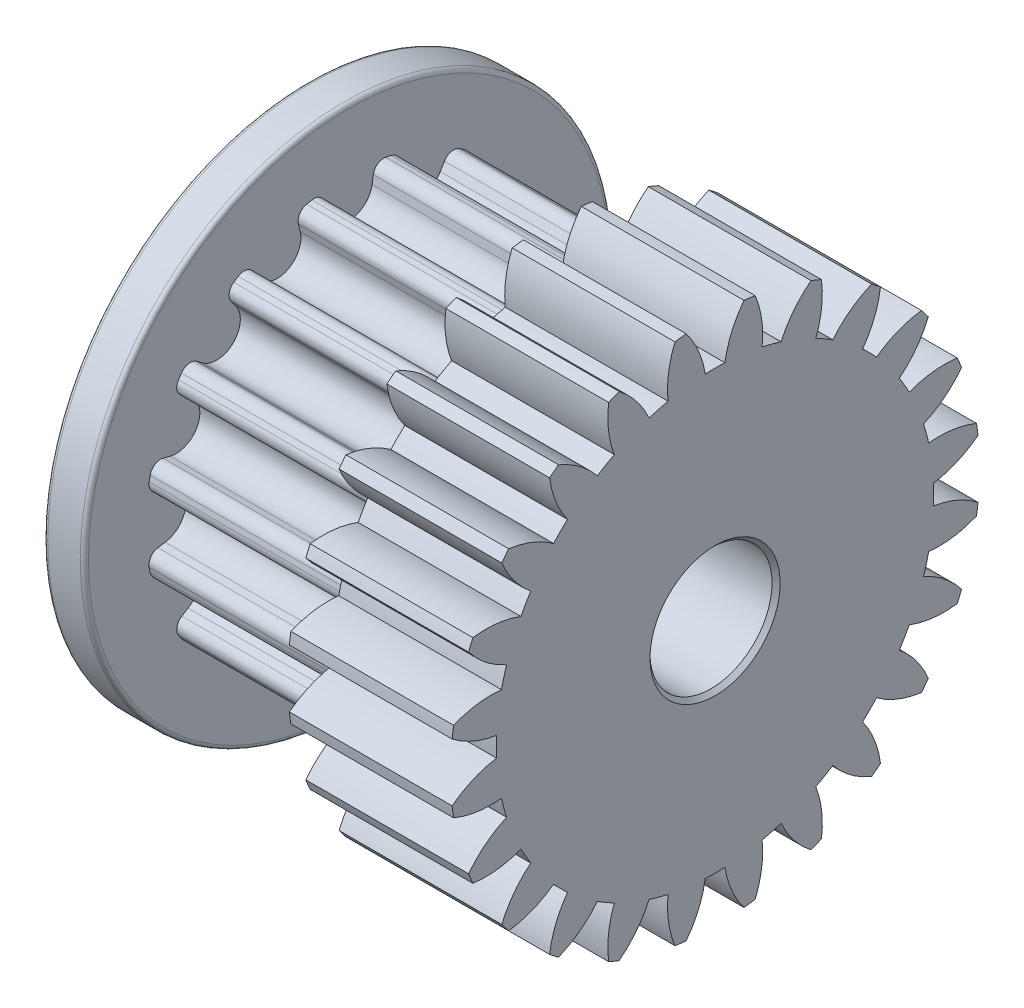
from build123d import *

# Parameters (mm, degrees)
SKETCH_1_R          = 1.5
EXTRUDE_1_DEPTH     = 4
EXTRUDE_2_DEPTH     = 5
EXTRUDE_START       = 1
SKETCH_3_R          = 6.5
EXTRUDE_3_DEPTH     = 1
SKETCH_5_R          = 1.5
CUT_EXTRUDE_1_DEPTH = 14.583077707
CHAMFER_1_SIZE      = 0.1
FILLET_1_R          = 0.1


with BuildPart() as part:
    # 草图1 → 凸台-拉伸1 (new body)
    with BuildSketch(Plane(origin=(0, 0, 0), x_dir=(0, -1, 0), z_dir=(-1, 0, 0))):
        with BuildLine():
            ThreePointArc((-0.711337602, 6.460959589), (-0.848420249, 6.444391599), (-0.98512003, 6.424915449))
            ThreePointArc((-0.98512003, 6.424915449), (-1.144628565, 5.84730165), (-1.156074481, 5.248177569))
            ThreePointArc((-1.156074481, 5.248177569), (-1.390893548, 5.19088539), (-1.622898915, 5.123092339))
            ThreePointArc((-1.622898915, 5.123092339), (-1.93237341, 5.636226055), (-2.359318752, 6.056700011))
            ThreePointArc((-2.359318752, 6.056700011), (-2.48744231, 6.005216961), (-2.614443361, 5.951023938))
            ThreePointArc((-2.614443361, 5.951023938), (-2.619019322, 5.351808006), (-2.475010506, 4.770136161))
            ThreePointArc((-2.475010506, 4.770136161), (-2.687, 4.65402052), (-2.893553842, 4.528490053))
            ThreePointArc((-2.893553842, 4.528490053), (-3.325292028, 4.944041268), (-3.846516229, 5.239686336))
            ThreePointArc((-3.846516229, 5.239686336), (-3.956949289, 5.156796712), (-4.065596697, 5.071579981))
            ThreePointArc((-4.065596697, 5.071579981), (-3.91492824, 4.49159749), (-3.625278654, 3.967017857))
            ThreePointArc((-3.625278654, 3.967017857), (-3.799991842, 3.799991842), (-3.967017857, 3.625278654))
            ThreePointArc((-3.967017857, 3.625278654), (-4.49159749, 3.91492824), (-5.071579981, 4.065596697))
            ThreePointArc((-5.071579981, 4.065596697), (-5.156796712, 3.956949289), (-5.239686336, 3.846516229))
            ThreePointArc((-5.239686336, 3.846516229), (-4.944041268, 3.325292028), (-4.528490053, 2.893553842))
            ThreePointArc((-4.528490053, 2.893553842), (-4.65402052, 2.687), (-4.770136161, 2.475010506))
            ThreePointArc((-4.770136161, 2.475010506), (-5.351808006, 2.619019322), (-5.951023938, 2.614443361))
            ThreePointArc((-5.951023938, 2.614443361), (-6.005216961, 2.48744231), (-6.056700011, 2.359318752))
            ThreePointArc((-6.056700011, 2.359318752), (-5.636226055, 1.93237341), (-5.123092339, 1.622898915))
            ThreePointArc((-5.123092339, 1.622898915), (-5.19088539, 1.390893548), (-5.248177569, 1.156074481))
            ThreePointArc((-5.248177569, 1.156074481), (-5.84730165, 1.144628565), (-6.424915449, 0.98512003))
            ThreePointArc((-6.424915449, 0.98512003), (-6.444391599, 0.848420249), (-6.460959589, 0.711337602))
            ThreePointArc((-6.460959589, 0.711337602), (-5.94431135, 0.407766737), (-5.368564348, 0.241646108))
            ThreePointArc((-5.368564348, 0.241646108), (-5.374, 0), (-5.368564348, -0.241646108))
            ThreePointArc((-5.368564348, -0.241646108), (-5.94431135, -0.407766737), (-6.460959589, -0.711337602))
            ThreePointArc((-6.460959589, -0.711337602), (-6.444391599, -0.848420249), (-6.424915449, -0.98512003))
            ThreePointArc((-6.424915449, -0.98512003), (-5.84730165, -1.144628565), (-5.248177569, -1.156074481))
            ThreePointArc((-5.248177569, -1.156074481), (-5.19088539, -1.390893548), (-5.123092339, -1.622898915))
            ThreePointArc((-5.123092339, -1.622898915), (-5.636226055, -1.93237341), (-6.056700011, -2.359318752))
            ThreePointArc((-6.056700011, -2.359318752), (-6.005216961, -2.48744231), (-5.951023938, -2.614443361))
            ThreePointArc((-5.951023938, -2.614443361), (-5.351808006, -2.619019322), (-4.770136161, -2.475010506))
            ThreePointArc((-4.770136161, -2.475010506), (-4.65402052, -2.687), (-4.528490053, -2.893553842))
            ThreePointArc((-4.528490053, -2.893553842), (-4.944041268, -3.325292028), (-5.239686336, -3.846516229))
            ThreePointArc((-5.239686336, -3.846516229), (-5.156796712, -3.956949289), (-5.071579981, -4.065596697))
            ThreePointArc((-5.071579981, -4.065596697), (-4.49159749, -3.91492824), (-3.967017857, -3.625278654))
            ThreePointArc((-3.967017857, -3.625278654), (-3.799991842, -3.799991842), (-3.625278654, -3.967017857))
            ThreePointArc((-3.625278654, -3.967017857), (-3.91492824, -4.49159749), (-4.065596697, -5.071579981))
            ThreePointArc((-4.065596697, -5.071579981), (-3.956949289, -5.156796712), (-3.846516229, -5.239686336))
            ThreePointArc((-3.846516229, -5.239686336), (-3.325292028, -4.944041268), (-2.893553842, -4.528490053))
            ThreePointArc((-2.893553842, -4.528490053), (-2.687, -4.65402052), (-2.475010506, -4.770136161))
            ThreePointArc((-2.475010506, -4.770136161), (-2.619019322, -5.351808006), (-2.614443361, -5.951023938))
            ThreePointArc((-2.614443361, -5.951023938), (-2.48744231, -6.005216961), (-2.359318752, -6.056700011))
            ThreePointArc((-2.359318752, -6.056700011), (-1.93237341, -5.636226055), (-1.622898915, -5.123092339))
            ThreePointArc((-1.622898915, -5.123092339), (-1.390893548, -5.19088539), (-1.156074481, -5.248177569))
            ThreePointArc((-1.156074481, -5.248177569), (-1.144628565, -5.84730165), (-0.98512003, -6.424915449))
            ThreePointArc((-0.98512003, -6.424915449), (-0.848420249, -6.444391599), (-0.711337602, -6.460959589))
            ThreePointArc((-0.711337602, -6.460959589), (-0.407766737, -5.94431135), (-0.241646108, -5.368564348))
            ThreePointArc((-0.241646108, -5.368564348), (0, -5.374), (0.241646108, -5.368564348))
            ThreePointArc((0.241646108, -5.368564348), (0.407766737, -5.94431135), (0.711337602, -6.460959589))
            ThreePointArc((0.711337602, -6.460959589), (0.848420249, -6.444391599), (0.98512003, -6.424915449))
            ThreePointArc((0.98512003, -6.424915449), (1.144628565, -5.84730165), (1.156074481, -5.248177569))
            ThreePointArc((1.156074481, -5.248177569), (1.390893548, -5.19088539), (1.622898915, -5.123092339))
            ThreePointArc((1.622898915, -5.123092339), (1.93237341, -5.636226055), (2.359318752, -6.056700011))
            ThreePointArc((2.359318752, -6.056700011), (2.48744231, -6.005216961), (2.614443361, -5.951023938))
            ThreePointArc((2.614443361, -5.951023938), (2.619019322, -5.351808006), (2.475010506, -4.770136161))
            ThreePointArc((2.475010506, -4.770136161), (2.687, -4.65402052), (2.893553842, -4.528490053))
            ThreePointArc((2.893553842, -4.528490053), (3.325292028, -4.944041268), (3.846516229, -5.239686336))
            ThreePointArc((3.846516229, -5.239686336), (3.956949289, -5.156796712), (4.065596697, -5.071579981))
            ThreePointArc((4.065596697, -5.071579981), (3.91492824, -4.49159749), (3.625278654, -3.967017857))
            ThreePointArc((3.625278654, -3.967017857), (3.799991842, -3.799991842), (3.967017857, -3.625278654))
            ThreePointArc((3.967017857, -3.625278654), (4.49159749, -3.91492824), (5.071579981, -4.065596697))
            ThreePointArc((5.071579981, -4.065596697), (5.156796712, -3.956949289), (5.239686336, -3.846516229))
            ThreePointArc((5.239686336, -3.846516229), (4.944041268, -3.325292028), (4.528490053, -2.893553842))
            ThreePointArc((4.528490053, -2.893553842), (4.65402052, -2.687), (4.770136161, -2.475010506))
            ThreePointArc((4.770136161, -2.475010506), (5.351808006, -2.619019322), (5.951023938, -2.614443361))
            ThreePointArc((5.951023938, -2.614443361), (6.005216961, -2.48744231), (6.056700011, -2.359318752))
            ThreePointArc((6.056700011, -2.359318752), (5.636226055, -1.93237341), (5.123092339, -1.622898915))
            ThreePointArc((5.123092339, -1.622898915), (5.19088539, -1.390893548), (5.248177569, -1.156074481))
            ThreePointArc((5.248177569, -1.156074481), (5.84730165, -1.144628565), (6.424915449, -0.98512003))
            ThreePointArc((6.424915449, -0.98512003), (6.444391599, -0.848420249), (6.460959589, -0.711337602))
            ThreePointArc((6.460959589, -0.711337602), (5.94431135, -0.407766737), (5.368564348, -0.241646108))
            ThreePointArc((5.368564348, -0.241646108), (5.374, 0), (5.368564348, 0.241646108))
            ThreePointArc((5.368564348, 0.241646108), (5.94431135, 0.407766737), (6.460959589, 0.711337602))
            ThreePointArc((6.460959589, 0.711337602), (6.444391599, 0.848420249), (6.424915449, 0.98512003))
            ThreePointArc((6.424915449, 0.98512003), (5.84730165, 1.144628565), (5.248177569, 1.156074481))
            ThreePointArc((5.248177569, 1.156074481), (5.19088539, 1.390893548), (5.123092339, 1.622898915))
            ThreePointArc((5.123092339, 1.622898915), (5.636226055, 1.93237341), (6.056700011, 2.359318752))
            ThreePointArc((6.056700011, 2.359318752), (6.005216961, 2.48744231), (5.951023938, 2.614443361))
            ThreePointArc((5.951023938, 2.614443361), (5.351808006, 2.619019322), (4.770136161, 2.475010506))
            ThreePointArc((4.770136161, 2.475010506), (4.65402052, 2.687), (4.528490053, 2.893553842))
            ThreePointArc((4.528490053, 2.893553842), (4.944041268, 3.325292028), (5.239686336, 3.846516229))
            ThreePointArc((5.239686336, 3.846516229), (5.156796712, 3.956949289), (5.071579981, 4.065596697))
            ThreePointArc((5.071579981, 4.065596697), (4.49159749, 3.91492824), (3.967017857, 3.625278654))
            ThreePointArc((3.967017857, 3.625278654), (3.799991842, 3.799991842), (3.625278654, 3.967017857))
            ThreePointArc((3.625278654, 3.967017857), (3.91492824, 4.49159749), (4.065596697, 5.071579981))
            ThreePointArc((4.065596697, 5.071579981), (3.956949289, 5.156796712), (3.846516229, 5.239686336))
            ThreePointArc((3.846516229, 5.239686336), (3.325292028, 4.944041268), (2.893553842, 4.528490053))
            ThreePointArc((2.893553842, 4.528490053), (2.687, 4.65402052), (2.475010506, 4.770136161))
            ThreePointArc((2.475010506, 4.770136161), (2.619019322, 5.351808006), (2.614443361, 5.951023938))
            ThreePointArc((2.614443361, 5.951023938), (2.48744231, 6.005216961), (2.359318752, 6.056700011))
            ThreePointArc((2.359318752, 6.056700011), (1.93237341, 5.636226055), (1.622898915, 5.123092339))
            ThreePointArc((1.622898915, 5.123092339), (1.390893548, 5.19088539), (1.156074481, 5.248177569))
            ThreePointArc((1.156074481, 5.248177569), (1.144628565, 5.84730165), (0.98512003, 6.424915449))
            ThreePointArc((0.98512003, 6.424915449), (0.848420249, 6.444391599), (0.711337602, 6.460959589))
            ThreePointArc((0.711337602, 6.460959589), (0.407766737, 5.94431135), (0.241646108, 5.368564348))
            ThreePointArc((0.241646108, 5.368564348), (0, 5.374), (-0.241646108, 5.368564348))
            ThreePointArc((-0.241646108, 5.368564348), (-0.407766737, 5.94431135), (-0.711337602, 6.460959589))
        make_face()
        with Locations(Location((0, 0, 0), (0, 0, 90))):
            Circle(SKETCH_1_R, mode=Mode.SUBTRACT)
    extrude(amount=-EXTRUDE_1_DEPTH)

    # 草图2 → 凸台-拉伸2 (add)
    with BuildSketch(Plane.ZY):
        with BuildLine():
            Line((0.973500707, 4.894118549), (1.037379867, 4.881412194))
            ThreePointArc((1.037379867, 4.881412194), (1.206083752, 4.765877122), (1.239075855, 4.564082984))
            Line((1.239075855, 4.564082984), (1.190890986, 4.368931892))
            ThreePointArc((1.190890986, 4.368931892), (1.544766642, 3.700642421), (2.258591893, 3.950226689))
            Line((2.258591893, 3.950226689), (2.351135088, 4.103452967))
            ThreePointArc((2.351135088, 4.103452967), (2.517154032, 4.222814031), (2.718141325, 4.185218003))
            Line((2.718141325, 4.185218003), (2.772295463, 4.149033365))
            Line((2.772295463, 4.149033365), (2.8264496, 4.112848728))
            ThreePointArc((2.8264496, 4.112848728), (2.938098308, 3.941548058), (2.891355764, 3.742489052))
            Line((2.891355764, 3.742489052), (2.77215766, 3.580632503))
            ThreePointArc((2.77215766, 3.580632503), (2.843352827, 2.827791189), (3.59835313, 2.785207889))
            Line((3.59835313, 2.785207889), (3.742489052, 2.891355764))
            ThreePointArc((3.742489052, 2.891355764), (3.941548058, 2.938098308), (4.112848728, 2.8264496))
            Line((4.112848728, 2.8264496), (4.149033365, 2.772295463))
            Line((4.149033365, 2.772295463), (4.185218003, 2.718141325))
            ThreePointArc((4.185218003, 2.718141325), (4.222814031, 2.517154032), (4.103452967, 2.351135088))
            Line((4.103452967, 2.351135088), (3.931388459, 2.247214275))
            ThreePointArc((3.931388459, 2.247214275), (3.709064318, 1.524434383), (4.390297723, 1.196166436))
            Line((4.390297723, 1.196166436), (4.564082984, 1.239075855))
            ThreePointArc((4.564082984, 1.239075855), (4.765877122, 1.206083752), (4.881412194, 1.037379867))
            Line((4.881412194, 1.037379867), (4.894118549, 0.973500707))
            Line((4.894118549, 0.973500707), (4.906824904, 0.909621546))
            ThreePointArc((4.906824904, 0.909621546), (4.864644598, 0.709546123), (4.690836654, 0.60184212))
            Line((4.690836654, 0.60184212), (4.492101004, 0.571678044))
            ThreePointArc((4.492101004, 0.571678044), (4.010104391, -0.011003739), (4.513859285, -0.574980514))
            Line((4.513859285, -0.574980514), (4.690836654, -0.60184212))
            ThreePointArc((4.690836654, -0.60184212), (4.864644598, -0.709546123), (4.906824904, -0.909621546))
            Line((4.906824904, -0.909621546), (4.894118549, -0.973500707))
            Line((4.894118549, -0.973500707), (4.881412194, -1.037379867))
            ThreePointArc((4.881412194, -1.037379867), (4.765877122, -1.206083752), (4.564082984, -1.239075855))
            Line((4.564082984, -1.239075855), (4.368931892, -1.190890986))
            ThreePointArc((4.368931892, -1.190890986), (3.700642421, -1.544766642), (3.950226689, -2.258591893))
            Line((3.950226689, -2.258591893), (4.103452967, -2.351135088))
            ThreePointArc((4.103452967, -2.351135088), (4.222814031, -2.517154032), (4.185218003, -2.718141325))
            Line((4.185218003, -2.718141325), (4.149033365, -2.772295463))
            Line((4.149033365, -2.772295463), (4.112848728, -2.8264496))
            ThreePointArc((4.112848728, -2.8264496), (3.941548058, -2.938098308), (3.742489052, -2.891355764))
            Line((3.742489052, -2.891355764), (3.580632503, -2.77215766))
            ThreePointArc((3.580632503, -2.77215766), (2.827791189, -2.843352827), (2.785207889, -3.59835313))
            Line((2.785207889, -3.59835313), (2.891355764, -3.742489052))
            ThreePointArc((2.891355764, -3.742489052), (2.938098308, -3.941548058), (2.8264496, -4.112848728))
            Line((2.8264496, -4.112848728), (2.772295463, -4.149033365))
            Line((2.772295463, -4.149033365), (2.718141325, -4.185218003))
            ThreePointArc((2.718141325, -4.185218003), (2.517154032, -4.222814031), (2.351135088, -4.103452967))
            Line((2.351135088, -4.103452967), (2.247214275, -3.931388459))
            ThreePointArc((2.247214275, -3.931388459), (1.524434383, -3.709064318), (1.196166436, -4.390297723))
            Line((1.196166436, -4.390297723), (1.239075855, -4.564082984))
            ThreePointArc((1.239075855, -4.564082984), (1.206083752, -4.765877122), (1.037379867, -4.881412194))
            Line((1.037379867, -4.881412194), (0.973500707, -4.894118549))
            Line((0.973500707, -4.894118549), (0.909621546, -4.906824904))
            ThreePointArc((0.909621546, -4.906824904), (0.709546123, -4.864644598), (0.60184212, -4.690836654))
            Line((0.60184212, -4.690836654), (0.571678044, -4.492101004))
            ThreePointArc((0.571678044, -4.492101004), (-0.011003739, -4.010104391), (-0.574980514, -4.513859285))
            Line((-0.574980514, -4.513859285), (-0.60184212, -4.690836654))
            ThreePointArc((-0.60184212, -4.690836654), (-0.709546123, -4.864644598), (-0.909621546, -4.906824904))
            Line((-0.909621546, -4.906824904), (-0.973500707, -4.894118549))
            Line((-0.973500707, -4.894118549), (-1.037379867, -4.881412194))
            ThreePointArc((-1.037379867, -4.881412194), (-1.206083752, -4.765877122), (-1.239075855, -4.564082984))
            Line((-1.239075855, -4.564082984), (-1.190890986, -4.368931892))
            ThreePointArc((-1.190890986, -4.368931892), (-1.544766642, -3.700642421), (-2.258591893, -3.950226689))
            Line((-2.258591893, -3.950226689), (-2.351135088, -4.103452967))
            ThreePointArc((-2.351135088, -4.103452967), (-2.517154032, -4.222814031), (-2.718141325, -4.185218003))
            Line((-2.718141325, -4.185218003), (-2.772295463, -4.149033365))
            Line((-2.772295463, -4.149033365), (-2.8264496, -4.112848728))
            ThreePointArc((-2.8264496, -4.112848728), (-2.938098308, -3.941548058), (-2.891355764, -3.742489052))
            Line((-2.891355764, -3.742489052), (-2.77215766, -3.580632503))
            ThreePointArc((-2.77215766, -3.580632503), (-2.843352827, -2.827791189), (-3.59835313, -2.785207889))
            Line((-3.59835313, -2.785207889), (-3.742489052, -2.891355764))
            ThreePointArc((-3.742489052, -2.891355764), (-3.941548058, -2.938098308), (-4.112848728, -2.8264496))
            Line((-4.112848728, -2.8264496), (-4.149033365, -2.772295463))
            Line((-4.149033365, -2.772295463), (-4.185218003, -2.718141325))
            ThreePointArc((-4.185218003, -2.718141325), (-4.222814031, -2.517154032), (-4.103452967, -2.351135088))
            Line((-4.103452967, -2.351135088), (-3.931388459, -2.247214275))
            ThreePointArc((-3.931388459, -2.247214275), (-3.709064318, -1.524434383), (-4.390297723, -1.196166436))
            Line((-4.390297723, -1.196166436), (-4.564082984, -1.239075855))
            ThreePointArc((-4.564082984, -1.239075855), (-4.765877122, -1.206083752), (-4.881412194, -1.037379867))
            Line((-4.881412194, -1.037379867), (-4.894118549, -0.973500707))
            Line((-4.894118549, -0.973500707), (-4.906824904, -0.909621546))
            ThreePointArc((-4.906824904, -0.909621546), (-4.864644598, -0.709546123), (-4.690836654, -0.60184212))
            Line((-4.690836654, -0.60184212), (-4.492101004, -0.571678044))
            ThreePointArc((-4.492101004, -0.571678044), (-4.010104391, 0.011003739), (-4.513859285, 0.574980514))
            Line((-4.513859285, 0.574980514), (-4.690836654, 0.60184212))
            ThreePointArc((-4.690836654, 0.60184212), (-4.864644598, 0.709546123), (-4.906824904, 0.909621546))
            Line((-4.906824904, 0.909621546), (-4.894118549, 0.973500707))
            Line((-4.894118549, 0.973500707), (-4.881412194, 1.037379867))
            ThreePointArc((-4.881412194, 1.037379867), (-4.765877122, 1.206083752), (-4.564082984, 1.239075855))
            Line((-4.564082984, 1.239075855), (-4.368931892, 1.190890986))
            ThreePointArc((-4.368931892, 1.190890986), (-3.700642421, 1.544766642), (-3.950226689, 2.258591893))
            Line((-3.950226689, 2.258591893), (-4.103452967, 2.351135088))
            ThreePointArc((-4.103452967, 2.351135088), (-4.222814031, 2.517154032), (-4.185218003, 2.718141325))
            Line((-4.185218003, 2.718141325), (-4.149033365, 2.772295463))
            Line((-4.149033365, 2.772295463), (-4.112848728, 2.8264496))
            ThreePointArc((-4.112848728, 2.8264496), (-3.941548058, 2.938098308), (-3.742489052, 2.891355764))
            Line((-3.742489052, 2.891355764), (-3.580632503, 2.77215766))
            ThreePointArc((-3.580632503, 2.77215766), (-2.827791189, 2.843352827), (-2.785207889, 3.59835313))
            Line((-2.785207889, 3.59835313), (-2.891355764, 3.742489052))
            ThreePointArc((-2.891355764, 3.742489052), (-2.938098308, 3.941548058), (-2.8264496, 4.112848728))
            Line((-2.8264496, 4.112848728), (-2.772295463, 4.149033365))
            Line((-2.772295463, 4.149033365), (-2.718141325, 4.185218003))
            ThreePointArc((-2.718141325, 4.185218003), (-2.517154032, 4.222814031), (-2.351135088, 4.103452967))
            Line((-2.351135088, 4.103452967), (-2.247214275, 3.931388459))
            ThreePointArc((-2.247214275, 3.931388459), (-1.524434383, 3.709064318), (-1.196166436, 4.390297723))
            Line((-1.196166436, 4.390297723), (-1.239075855, 4.564082984))
            ThreePointArc((-1.239075855, 4.564082984), (-1.206083752, 4.765877122), (-1.037379867, 4.881412194))
            Line((-1.037379867, 4.881412194), (-0.973500707, 4.894118549))
            Line((-0.973500707, 4.894118549), (-0.909621546, 4.906824904))
            ThreePointArc((-0.909621546, 4.906824904), (-0.709546123, 4.864644598), (-0.60184212, 4.690836654))
            Line((-0.60184212, 4.690836654), (-0.571678044, 4.492101004))
            ThreePointArc((-0.571678044, 4.492101004), (0.011003739, 4.010104391), (0.574980514, 4.513859285))
            Line((0.574980514, 4.513859285), (0.60184212, 4.690836654))
            ThreePointArc((0.60184212, 4.690836654), (0.709546123, 4.864644598), (0.909621546, 4.906824904))
            Line((0.909621546, 4.906824904), (0.973500707, 4.894118549))
        make_face()
    extrude(amount=EXTRUDE_2_DEPTH)

    # 草图3 → 凸台-拉伸3 (add)
    with BuildSketch(Plane.ZY.offset(5).offset(EXTRUDE_START)):
        Circle(SKETCH_3_R)
    extrude(amount=-EXTRUDE_3_DEPTH)

    # 草图5 → 切除-拉伸1 (cut, through all)
    with BuildSketch(Plane(origin=(4, 0, 0), x_dir=(0, 0, -1), z_dir=(1, 0, 0))):
        with Locations(Location((0, 0, 0), (0, 0, 180))):
            Circle(SKETCH_5_R)
    extrude(amount=-CUT_EXTRUDE_1_DEPTH, mode=Mode.SUBTRACT)

    # 倒角1
    chamfer_1_edges = [part.edges().sort_by_distance(p)[0] for p in [
        (4, 0, -1.5),
        (-6, 0, -1.5),
    ]]
    chamfer(chamfer_1_edges, length=CHAMFER_1_SIZE)

    # 圆角1
    fillet_1_edges = [part.edges().sort_by_distance(p)[0] for p in [
        (-5, 0, -6.5),
        (-6, 0, -6.5),
    ]]
    fillet(fillet_1_edges, radius=FILLET_1_R)


solid = part.part
